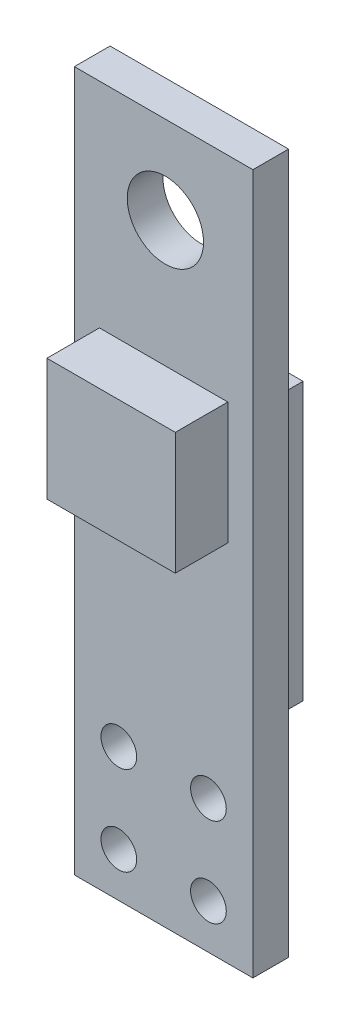
from build123d import *

# Parameters (mm, degrees)
SKETCH1_W           = 5.1
SKETCH1_H           = 20
SKETCH1_R           = 1.09
SKETCH1_R_2         = 0.51
BOSS_EXTRUDE1_DEPTH = 1.02
SKETCH2_W           = 3.667230494
SKETCH2_H           = 3.486682144
BOSS_EXTRUDE2_DEPTH = 1.5
SKETCH3_W           = 3.726930802
SKETCH3_H           = 7.906409835
BOSS_EXTRUDE3_DEPTH = 1.1


with BuildPart() as part:
    # Sketch1 → Boss-Extrude1 (new body)
    with BuildSketch(Plane.XY):
        Rectangle(SKETCH1_W, SKETCH1_H)
        with Locations((0.05, 7.5)):
            Circle(SKETCH1_R, mode=Mode.SUBTRACT)
        with Locations((-1.28, -6.19)):
            Circle(SKETCH1_R_2, mode=Mode.SUBTRACT)
        with Locations((1.28, -6.19)):
            Circle(SKETCH1_R_2, mode=Mode.SUBTRACT)
        with Locations((1.28, -8.73)):
            Circle(SKETCH1_R_2, mode=Mode.SUBTRACT)
        with Locations((-1.28, -8.73)):
            Circle(SKETCH1_R_2, mode=Mode.SUBTRACT)
    extrude(amount=BOSS_EXTRUDE1_DEPTH)

    # Sketch2 → Boss-Extrude2 (add)
    with BuildSketch(Plane.XY.offset(1.02)):
        with Locations((0, 2.15)):
            Rectangle(SKETCH2_W, SKETCH2_H)
    extrude(amount=BOSS_EXTRUDE2_DEPTH)

    # Sketch3 → Boss-Extrude3 (add)
    with BuildSketch(Plane(origin=(0, 0, 0), x_dir=(-1, 0, 0), z_dir=(0, 0, -1))):
        with Locations((0, -0.592550596)):
            Rectangle(SKETCH3_W, SKETCH3_H)
    extrude(amount=BOSS_EXTRUDE3_DEPTH)


solid = part.part
